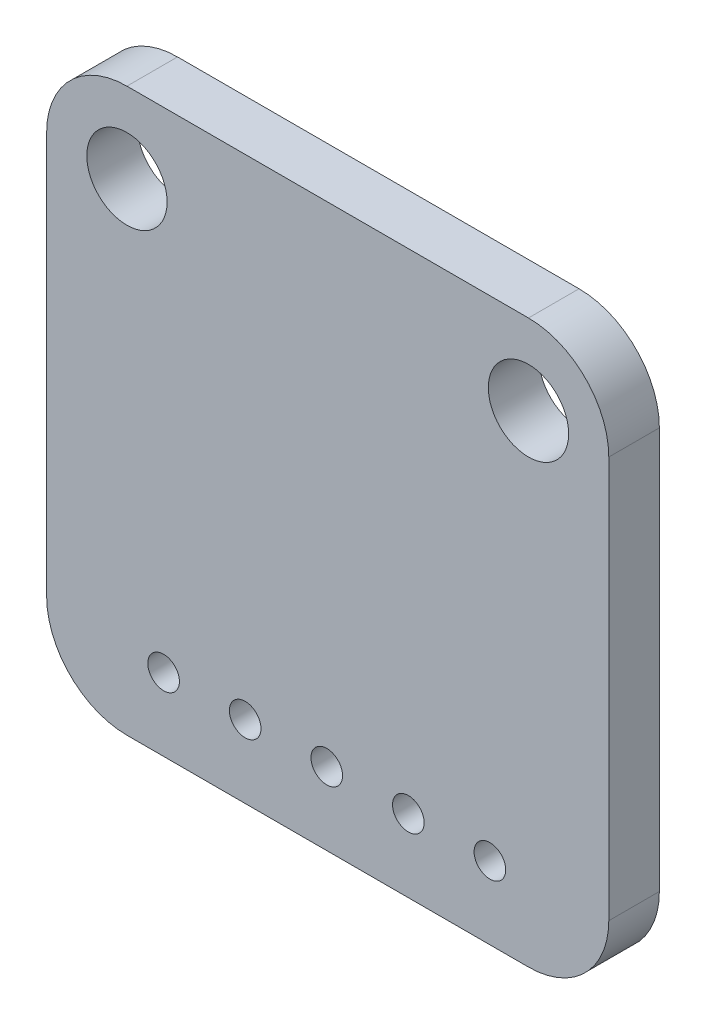
from build123d import *

# Parameters (mm, degrees)
SKETCH2_R               = 1.27
BOSS_EXTRUDE1_DEPTH     = 1.6
CUT_EXTRUDE1_DEPTH      = 13.673760294
CUT_EXTRUDE1_DEPTH_BACK = 13.673760294
SKETCH3_R               = 0.5


with BuildPart() as part:
    # Sketch2 → Boss-Extrude1 (new body)
    with BuildSketch(Plane.XY):
        with BuildLine():
            Line((-6.35, -8.89), (6.35, -8.89))
            ThreePointArc((6.35, -8.89), (8.146051224, -8.146051224), (8.89, -6.35))
            Line((8.89, -6.35), (8.89, 6.35))
            ThreePointArc((8.89, 6.35), (8.146051224, 8.146051224), (6.35, 8.89))
            Line((6.35, 8.89), (-6.35, 8.89))
            ThreePointArc((-6.35, 8.89), (-8.146051224, 8.146051224), (-8.89, 6.35))
            Line((-8.89, 6.35), (-8.89, -6.35))
            ThreePointArc((-8.89, -6.35), (-8.146051224, -8.146051224), (-6.35, -8.89))
        make_face()
        with Locations((-6.35, 6.35)):
            Circle(SKETCH2_R, mode=Mode.SUBTRACT)
        with Locations((6.35, 6.35)):
            Circle(SKETCH2_R, mode=Mode.SUBTRACT)
    extrude(amount=BOSS_EXTRUDE1_DEPTH)

    # Sketch3 → Cut-Extrude1 (cut, two sides: drawn at the far end of the back side and taken through both)
    with BuildSketch(Plane.XY.offset(1.6).offset(-CUT_EXTRUDE1_DEPTH_BACK)):
        with Locations((-5.19, -6.59)):
            Circle(SKETCH3_R)
        with Locations((-2.61, -6.59)):
            Circle(SKETCH3_R)
        with Locations((-0.03, -6.59)):
            Circle(SKETCH3_R)
        with Locations((2.55, -6.59)):
            Circle(SKETCH3_R)
        with Locations((5.13, -6.59)):
            Circle(SKETCH3_R)
    extrude(amount=CUT_EXTRUDE1_DEPTH + CUT_EXTRUDE1_DEPTH_BACK, mode=Mode.SUBTRACT)


solid = part.part
